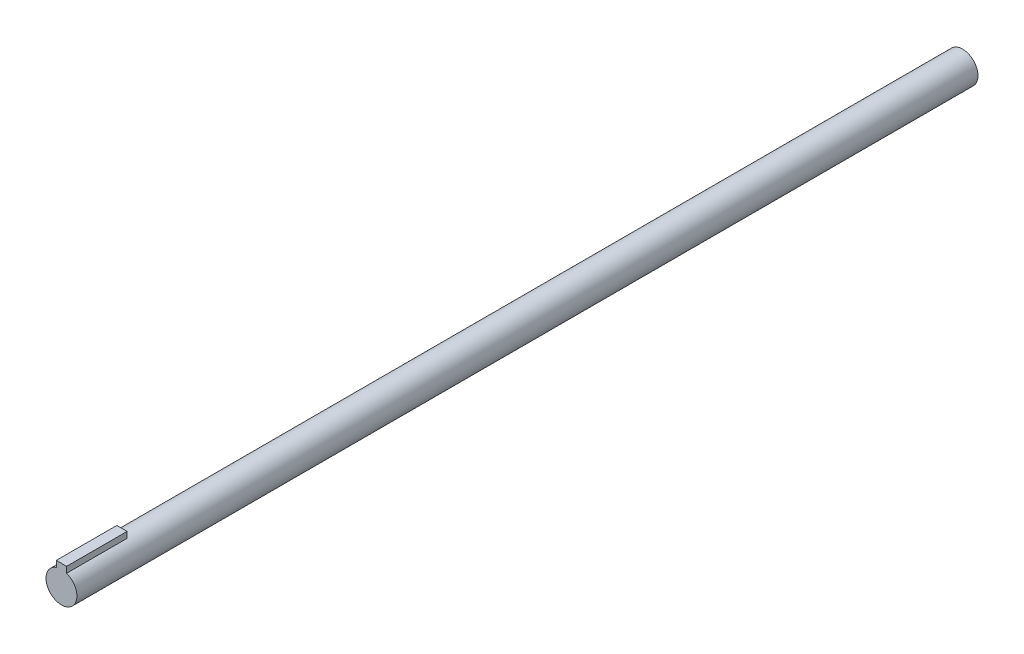
from build123d import *

# Parameters (mm, degrees)
SKETCH_1_R      = 6
EXTRUDE_1_DEPTH = 350
SKETCH_2_W      = 4
SKETCH_2_H      = 9.160592614
EXTRUDE_2_DEPTH = 23.51


with BuildPart() as part:
    # 草图1 → 凸台-拉伸1 (new body)
    with BuildSketch(Plane.XY):
        Circle(SKETCH_1_R)
    extrude(amount=EXTRUDE_1_DEPTH)

    # 草图2 → 凸台-拉伸2 (add)
    with BuildSketch(Plane.XY.offset(350)):
        with Locations((0, 3.419703693)):
            Rectangle(SKETCH_2_W, SKETCH_2_H)
    extrude(amount=-EXTRUDE_2_DEPTH)


solid = part.part
